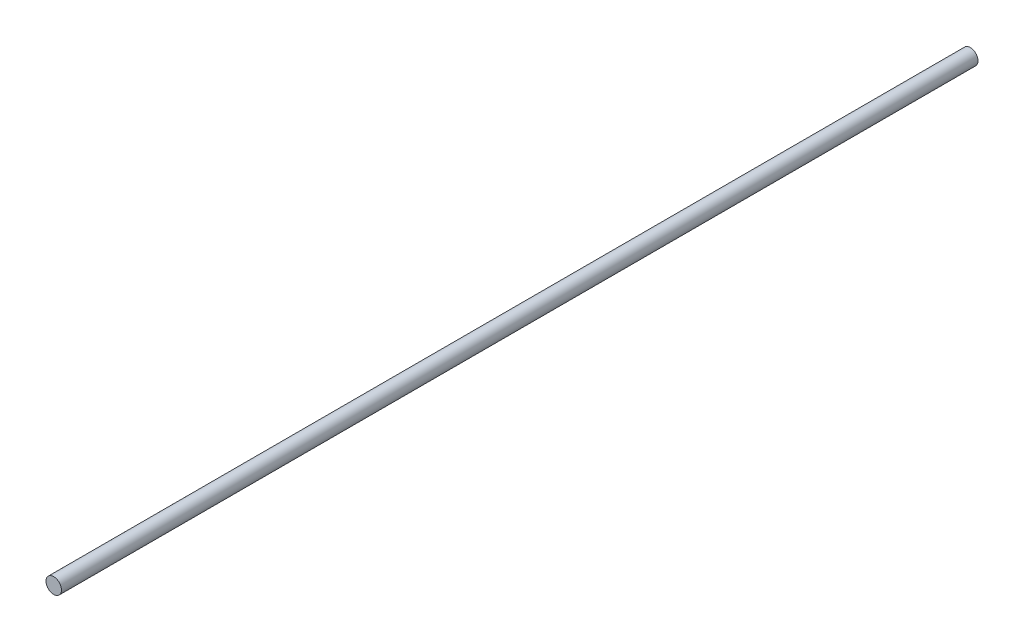
from build123d import *

# Parameters (mm, degrees)
CROQUIS1_R              = 3
SALIENTE_EXTRUIR1_DEPTH = 356


with BuildPart() as part:
    # Croquis1 → Saliente-Extruir1 (new body)
    with BuildSketch(Plane.XY):
        Circle(CROQUIS1_R)
    extrude(amount=SALIENTE_EXTRUIR1_DEPTH)


solid = part.part
